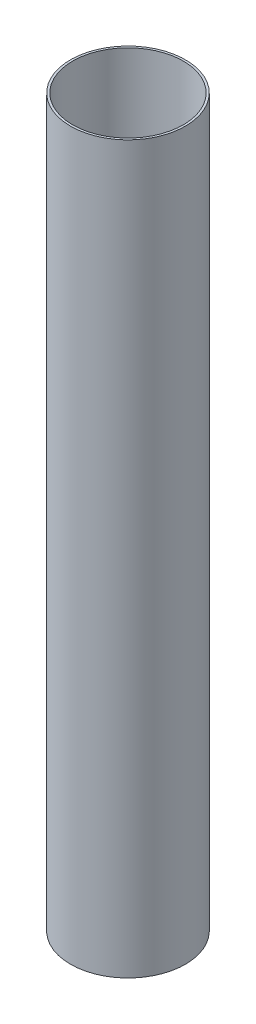
from build123d import *

# Parameters (mm, degrees)
SKETCH1_R               = 39.6
SKETCH1_R_2             = 38.1
BOSS_EXTRUDE1_DEPTH     = 500
CUT_EXTRUDE1_REACH      = 505.127
CUT_EXTRUDE1_END_RADIUS = 39.6
SKETCH2_R               = 2


with BuildPart() as part:
    # Sketch1 → Boss-Extrude1 (new body)
    with BuildSketch(Plane(origin=(0, 0, 0), x_dir=(1, 0, 0), z_dir=(0, 1, 0))):
        with Locations(Location((0, 0, 0), (0, 0, 270))):
            Circle(SKETCH1_R)
        with Locations(Location((0, 0, 0), (0, 0, 270))):
            Circle(SKETCH1_R_2, mode=Mode.SUBTRACT)
    extrude(amount=BOSS_EXTRUDE1_DEPTH)

    # Cut-Extrude1: up to this cylinder (the profile starts inside it)
    cut_extrude1_end = Plane(origin=(0, 289, 0), z_dir=(0, -1, 0)) * Cylinder(CUT_EXTRUDE1_END_RADIUS, 1090.454, mode=Mode.PRIVATE)
    # Sketch2 → Cut-Extrude1 (cut, up to the surface)
    with BuildSketch(Plane(origin=(0, 0, 0), x_dir=(0, 0, -1), z_dir=(1, 0, 0)), mode=Mode.PRIVATE) as cut_extrude1_sk1:
        with Locations((0, 289)):
            Circle(SKETCH2_R)
    cut_extrude1_tool1 = extrude(cut_extrude1_sk1.sketch, amount=-CUT_EXTRUDE1_REACH, mode=Mode.PRIVATE) & cut_extrude1_end
    add(cut_extrude1_tool1.solids().sort_by_distance((0, 289, 0))[0], mode=Mode.SUBTRACT)


solid = part.part
